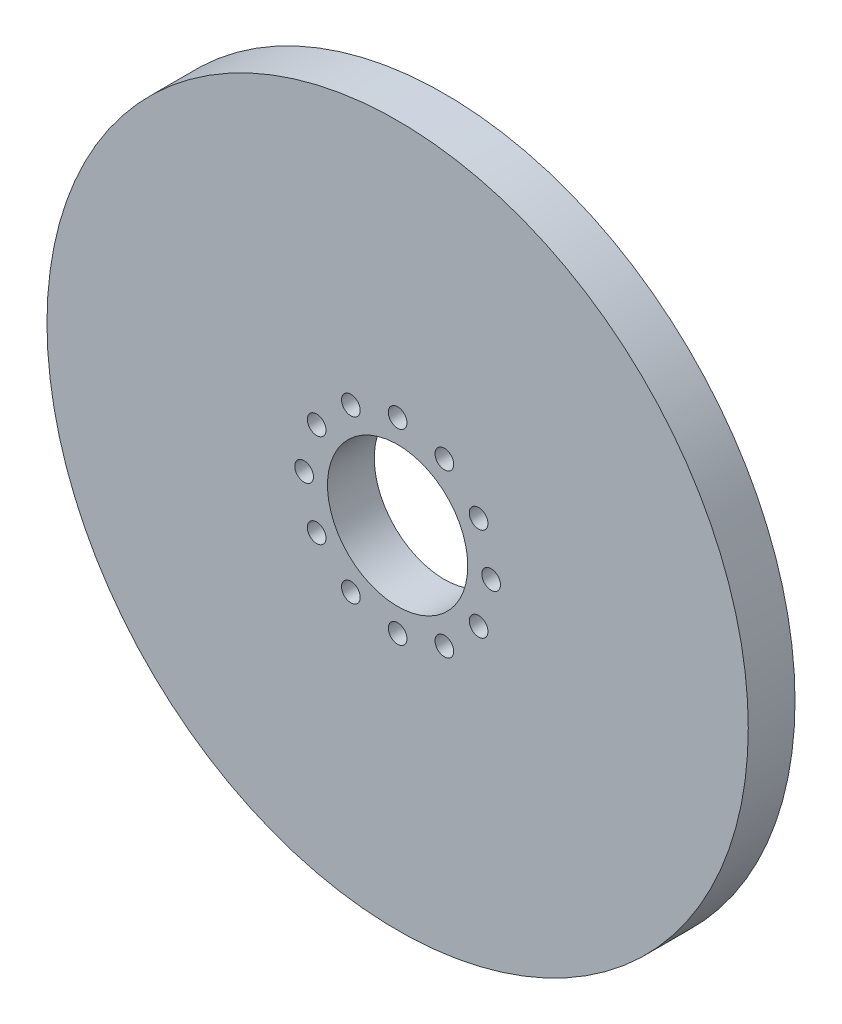
from build123d import *

# Parameters (mm, degrees)
SKETCH1_R           = 150
SKETCH1_R_2         = 30
SKETCH1_R_3         = 4
BOSS_EXTRUDE1_DEPTH = 20


with BuildPart() as part:
    # Sketch1 → Boss-Extrude1 (new body)
    with BuildSketch(Plane.XY):
        Circle(SKETCH1_R)
        Circle(SKETCH1_R_2, mode=Mode.SUBTRACT)
        with Locations((0, 40)):
            Circle(SKETCH1_R_3, mode=Mode.SUBTRACT)
        with Locations((20, 34.641016151)):
            Circle(SKETCH1_R_3, mode=Mode.SUBTRACT)
        with Locations((34.641016151, 20)):
            Circle(SKETCH1_R_3, mode=Mode.SUBTRACT)
        with Locations((40, 0)):
            Circle(SKETCH1_R_3, mode=Mode.SUBTRACT)
        with Locations((34.641016151, -20)):
            Circle(SKETCH1_R_3, mode=Mode.SUBTRACT)
        with Locations((20, -34.641016151)):
            Circle(SKETCH1_R_3, mode=Mode.SUBTRACT)
        with Locations((0, -40)):
            Circle(SKETCH1_R_3, mode=Mode.SUBTRACT)
        with Locations((-20, -34.641016151)):
            Circle(SKETCH1_R_3, mode=Mode.SUBTRACT)
        with Locations((-34.641016151, -20)):
            Circle(SKETCH1_R_3, mode=Mode.SUBTRACT)
        with Locations((-40, 0)):
            Circle(SKETCH1_R_3, mode=Mode.SUBTRACT)
        with Locations((-34.641016151, 20)):
            Circle(SKETCH1_R_3, mode=Mode.SUBTRACT)
        with Locations((-20, 34.641016151)):
            Circle(SKETCH1_R_3, mode=Mode.SUBTRACT)
    extrude(amount=BOSS_EXTRUDE1_DEPTH)


solid = part.part
